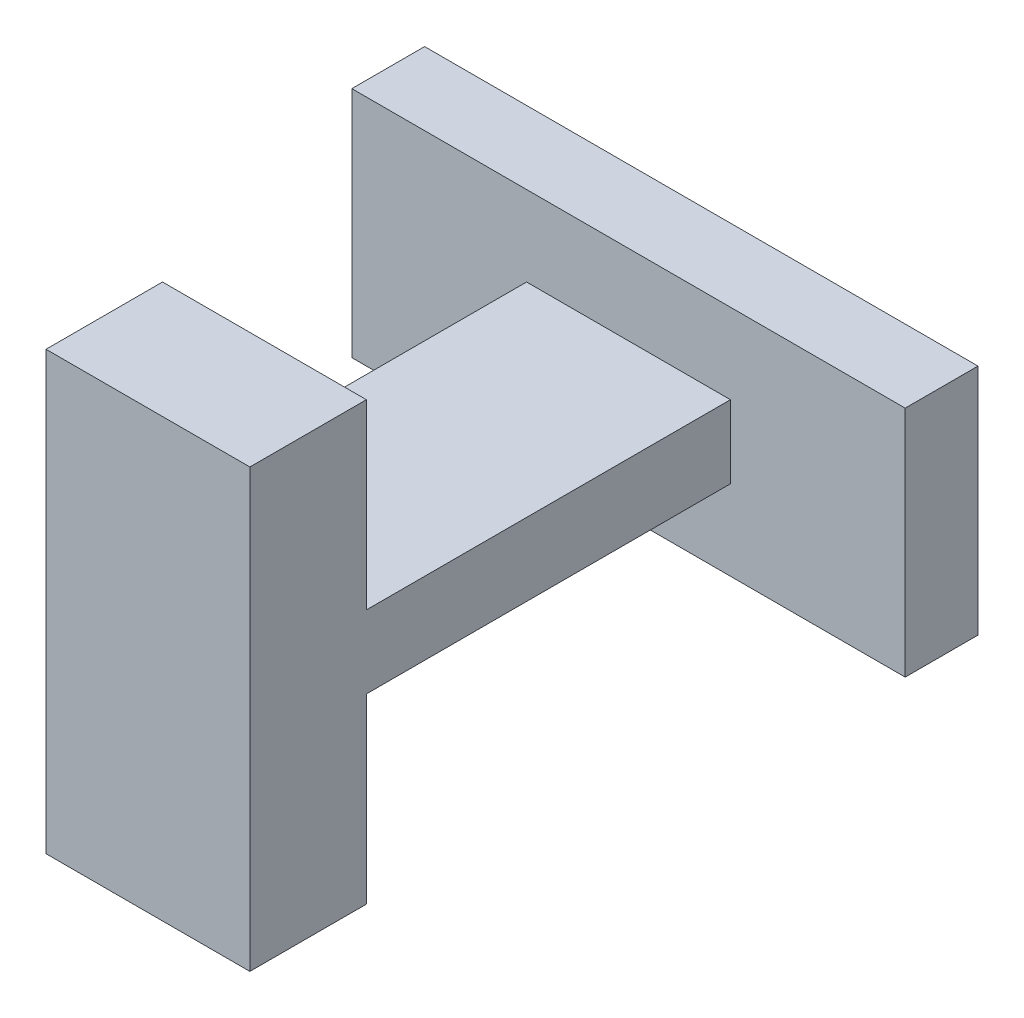
from build123d import *

# Parameters (mm, degrees)
SKETCH_1_W      = 38
SKETCH_1_H      = 16
EXTRUDE_1_DEPTH = 5
SKETCH_2_W      = 14
SKETCH_2_H      = 5
EXTRUDE_2_DEPTH = 25
SKETCH_3_W      = 14
SKETCH_3_H      = 30
EXTRUDE_3_DEPTH = 8


with BuildPart() as part:
    # 草图1 → 凸台-拉伸1 (new body)
    with BuildSketch(Plane.XY):
        Rectangle(SKETCH_1_W, SKETCH_1_H)
    extrude(amount=EXTRUDE_1_DEPTH)

    # 草图2 → 凸台-拉伸2 (add)
    with BuildSketch(Plane.XY.offset(5)):
        Rectangle(SKETCH_2_W, SKETCH_2_H)
    extrude(amount=EXTRUDE_2_DEPTH)

    # 草图3 → 凸台-拉伸3 (add)
    with BuildSketch(Plane.XY.offset(30)):
        Rectangle(SKETCH_3_W, SKETCH_3_H)
    extrude(amount=EXTRUDE_3_DEPTH)


solid = part.part
